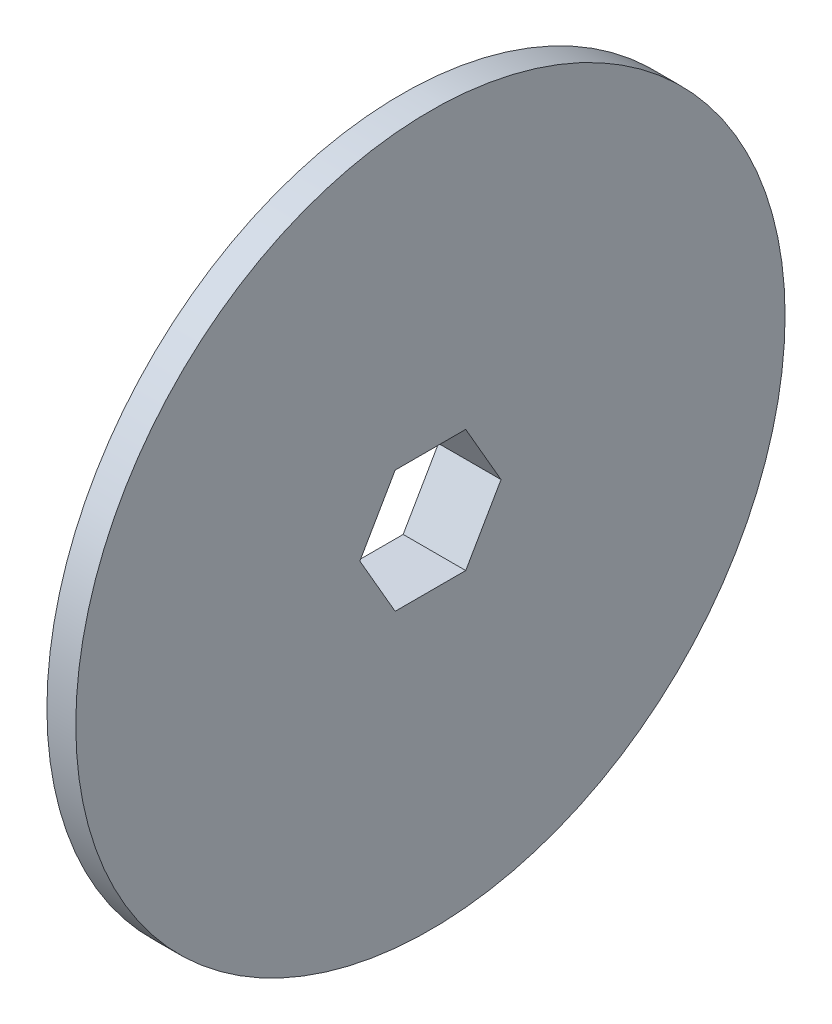
from build123d import *

# Parameters (mm, degrees)
CROQUIS1_R              = 14.345
SALIENTE_EXTRUIR1_DEPTH = 3.5
CROQUIS2_R              = 36.845
SALIENTE_EXTRUIR2_DEPTH = 3


with BuildPart() as part:
    # Croquis1 → Saliente-Extruir1 (new body)
    with BuildSketch(Plane(origin=(0, 0, 0), x_dir=(0, 0, -1), z_dir=(1, 0, 0))):
        Circle(CROQUIS1_R)
        Polygon((7.332348419, 0), (3.666174209, 6.35), (-3.666174209, 6.35), (-7.332348419, 0), (-3.666174209, -6.35), (3.666174209, -6.35), align=None, mode=Mode.SUBTRACT)
    extrude(amount=SALIENTE_EXTRUIR1_DEPTH)

    # Croquis2 → Saliente-Extruir2 (add)
    with BuildSketch(Plane(origin=(3.5, 0, 0), x_dir=(0, 0, -1), z_dir=(1, 0, 0))):
        Circle(CROQUIS2_R)
        Polygon((7.332348419, 0), (3.666174209, 6.35), (-3.666174209, 6.35), (-7.332348419, 0), (-3.666174209, -6.35), (3.666174209, -6.35), align=None, mode=Mode.SUBTRACT)
    extrude(amount=SALIENTE_EXTRUIR2_DEPTH)


solid = part.part
